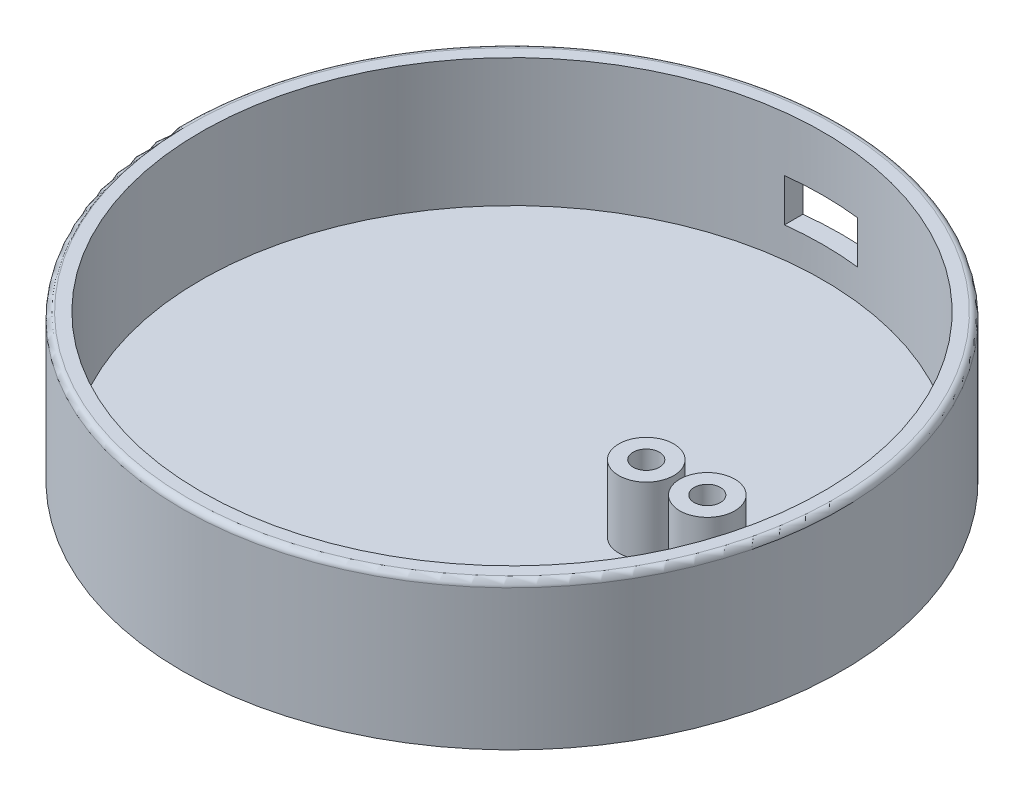
from build123d import *

# Parameters (mm, degrees)
SKETCH_1_R                     = 54
FLOOR_D108_T3_DEPTH            = 3
SKETCH_2_R                     = 54
SKETCH_2_R_2                   = 51
RIM_OD108_ID102_H24_DEPTH      = 24
SKETCH_3_R                     = 4.5
SENSOR_FIXED_POSTS_DEPTH       = 14
SKETCH_4_R                     = 2.15
M4_FIXED_MOUNT_CLEARANCE_DEPTH = 14
SKETCH_5_W                     = 12
SKETCH_5_H                     = 11
USB_C_SIDE_OPENING_12X7_DEPTH  = 7
BASE_OUTER_ROUND_R1_R          = 1


with BuildPart() as part:
    # 草图1 → Floor_D108_T3 (new body)
    with BuildSketch(Plane(origin=(0, 0, 0), x_dir=(1, 0, 0), z_dir=(0, 1, 0))):
        with Locations(Location((0, 0, 0), (0, 0, 270))):
            Circle(SKETCH_1_R)
    extrude(amount=FLOOR_D108_T3_DEPTH)

    # 草图2 → Rim_OD108_ID102_H24 (add)
    with BuildSketch(Plane(origin=(0, 0, 0), x_dir=(1, 0, 0), z_dir=(0, 1, 0))):
        with Locations(Location((0, 0, 0), (0, 0, 270))):
            Circle(SKETCH_2_R)
        with Locations(Location((0, 0, 0), (0, 0, 270))):
            Circle(SKETCH_2_R_2, mode=Mode.SUBTRACT)
    extrude(amount=RIM_OD108_ID102_H24_DEPTH)

    # 草图3 → Sensor_fixed_posts (add)
    with BuildSketch(Plane(origin=(0, 0, 0), x_dir=(1, 0, 0), z_dir=(0, 1, 0))):
        with Locations(Location((22, 0, 0), (0, 0, 270))):
            Circle(SKETCH_3_R)
        with Locations(Location((32, 0, 0), (0, 0, 270))):
            Circle(SKETCH_3_R)
    extrude(amount=SENSOR_FIXED_POSTS_DEPTH)

    # 草图4 → M4_fixed_mount_clearance (cut)
    with BuildSketch(Plane(origin=(0, 0, 0), x_dir=(1, 0, 0), z_dir=(0, 1, 0))):
        with Locations(Location((22, 0, 0), (0, 0, 270))):
            Circle(SKETCH_4_R)
        with Locations(Location((32, 0, 0), (0, 0, 270))):
            Circle(SKETCH_4_R)
    extrude(amount=M4_FIXED_MOUNT_CLEARANCE_DEPTH, mode=Mode.SUBTRACT)

    # 草图5 → USB_C_side_opening_12x7 (cut)
    with BuildSketch(Plane(origin=(0, 8, 0), x_dir=(1, 0, 0), z_dir=(0, 1, 0))):
        with Locations((0, 54.5)):
            Rectangle(SKETCH_5_W, SKETCH_5_H)
    extrude(amount=USB_C_SIDE_OPENING_12X7_DEPTH, mode=Mode.SUBTRACT)

    # Base_outer_round_R1
    base_outer_round_r1_edges = [part.edges().sort_by_distance(p)[0] for p in [
        (0, 24, -54),
    ]]
    fillet(base_outer_round_r1_edges, radius=BASE_OUTER_ROUND_R1_R)


solid = part.part
